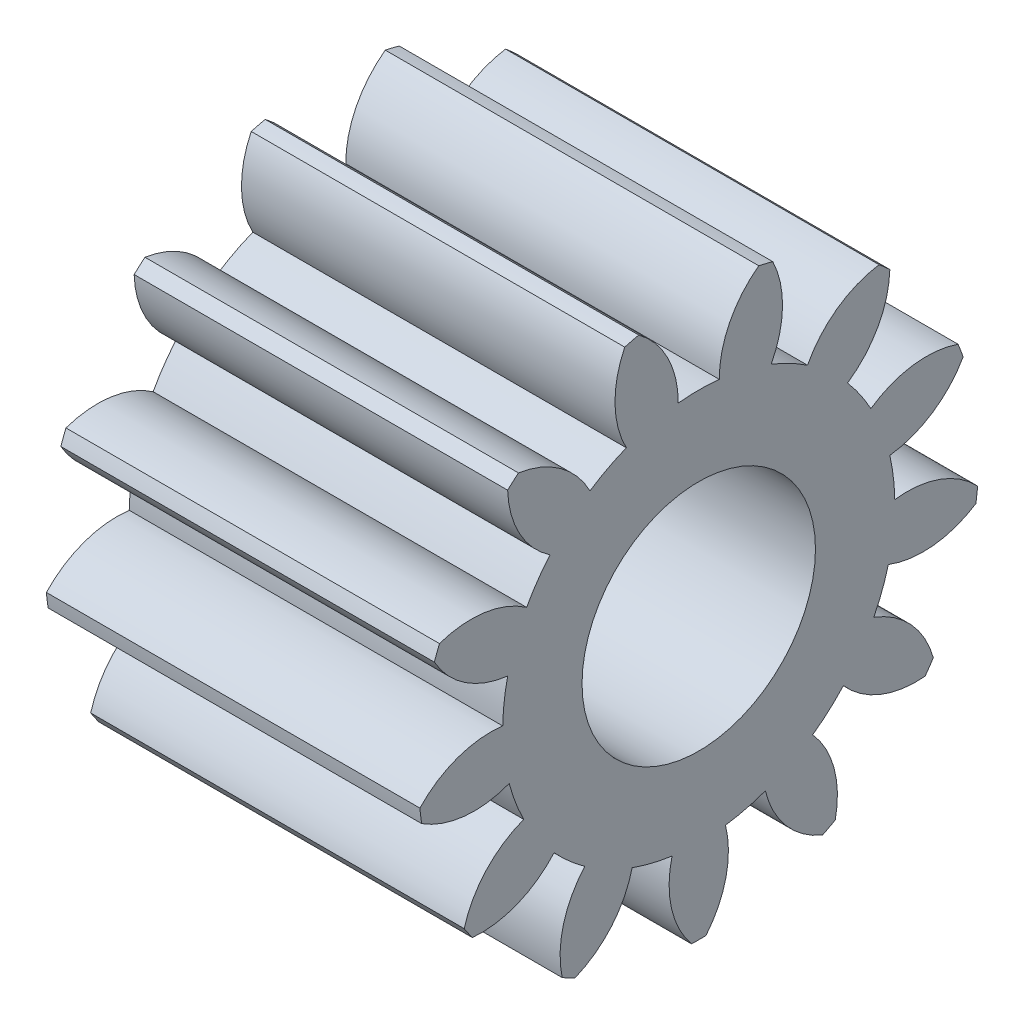
from build123d import *

# Parameters (mm, degrees)
BASPROSKE_W     = 8
BASPROSKE_H     = 6
TOOTHCUT_DEPTH  = 12.66190379
TEETHCUTS_COUNT = 13
TEETHCUTS_ANGLE = 332.307692308
BORSKE_R        = 2.5
BORE_DEPTH      = 50.0000508


with BuildPart() as part:
    # BasProSke → Base-Revolve (revolve)
    with BuildSketch(Plane(origin=(0, 0, 0), x_dir=(1, 0, 0), z_dir=(0, 1, 0)), mode=Mode.PRIVATE) as base_revolve_sk:
        with Locations((4, 3)):
            Rectangle(BASPROSKE_W, BASPROSKE_H)
    revolve(base_revolve_sk.sketch.rotate(Axis((-10, 0, 0), (1, 0, 0)), 180), axis=Axis((-10, 0, 0), (1, 0, 0)))

    # TooCutSke → ToothCut (cut, through all)
    with BuildSketch(Plane(origin=(0, 0, 0), x_dir=(0, 0, -1), z_dir=(1, 0, 0))):
        with BuildLine():
            ThreePointArc((0.439827119, 4.175901472), (0, 4.199), (-0.439827119, 4.175901472))
            ThreePointArc((-0.439827119, 4.175901472), (-0.668469058, 5.134732293), (-1.31288743, 5.880626817))
            ThreePointArc((-1.31288743, 5.880626817), (0, 6.0254), (1.31288743, 5.880626817))
            ThreePointArc((1.31288743, 5.880626817), (0.668469058, 5.134732293), (0.439827119, 4.175901472))
        make_face()
    toothcut = extrude(amount=TOOTHCUT_DEPTH, mode=Mode.SUBTRACT)

    # TeethCuts: ToothCut ×13 about axis
    teethcuts_axis = Axis((-10, 0, 0), (1, 0, 0))
    for i in range(1, TEETHCUTS_COUNT):
        add(toothcut.rotate(teethcuts_axis, i * TEETHCUTS_ANGLE / (TEETHCUTS_COUNT - 1)), mode=Mode.SUBTRACT)

    # BorSke → Bore (cut, symmetric)
    with BuildSketch(Plane(origin=(0, 0, 0), x_dir=(0, 0, -1), z_dir=(1, 0, 0))):
        with Locations(Location((0, 0, 0), (0, 0, 180))):
            Circle(BORSKE_R)
    extrude(amount=BORE_DEPTH, both=True, mode=Mode.SUBTRACT)


solid = part.part
